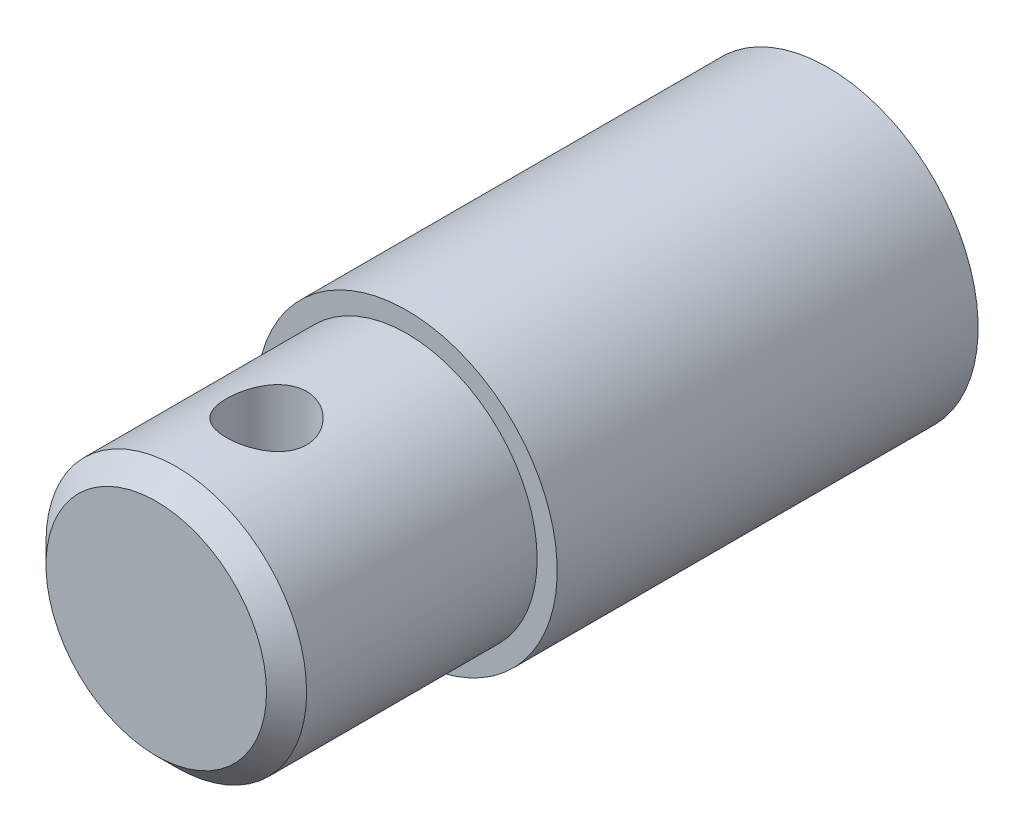
from build123d import *

# Parameters (mm, degrees)
SCHIZZO1_R             = 15
ESTRUSIONE1_DEPTH      = 42
SCHIZZO2_R             = 13
ESTRUSIONE2_DEPTH      = 25
SMUSSO1_SIZE           = 2
ESTRUSIONE3_DEPTH      = 71.278019323
ESTRUSIONE3_DEPTH_BACK = 71.278019323
SCHIZZO3_R             = 4


with BuildPart() as part:
    # Schizzo1 → Estrusione1 (new body)
    with BuildSketch(Plane.XY):
        with Locations(Location((0, 0, 0), (0, 0, 180))):
            Circle(SCHIZZO1_R)
    extrude(amount=ESTRUSIONE1_DEPTH)

    # Schizzo2 → Estrusione2 (add)
    with BuildSketch(Plane.XY.offset(42)):
        Circle(SCHIZZO2_R)
    extrude(amount=ESTRUSIONE2_DEPTH)

    # Smusso1
    smusso1_edges = [part.edges().sort_by_distance(p)[0] for p in [
        (-13, 0, 67),
    ]]
    chamfer(smusso1_edges, length=SMUSSO1_SIZE)

    # Schizzo3 → Estrusione3 (cut, two sides: drawn at the far end of the back side and taken through both)
    with BuildSketch(Plane(origin=(0, 0, 0), x_dir=(1, 0, 0), z_dir=(0, 1, 0)).offset(-ESTRUSIONE3_DEPTH_BACK)):
        with Locations(Location((0, -56, 0), (0, 0, 270))):
            Circle(SCHIZZO3_R)
    extrude(amount=ESTRUSIONE3_DEPTH + ESTRUSIONE3_DEPTH_BACK, mode=Mode.SUBTRACT)


solid = part.part
